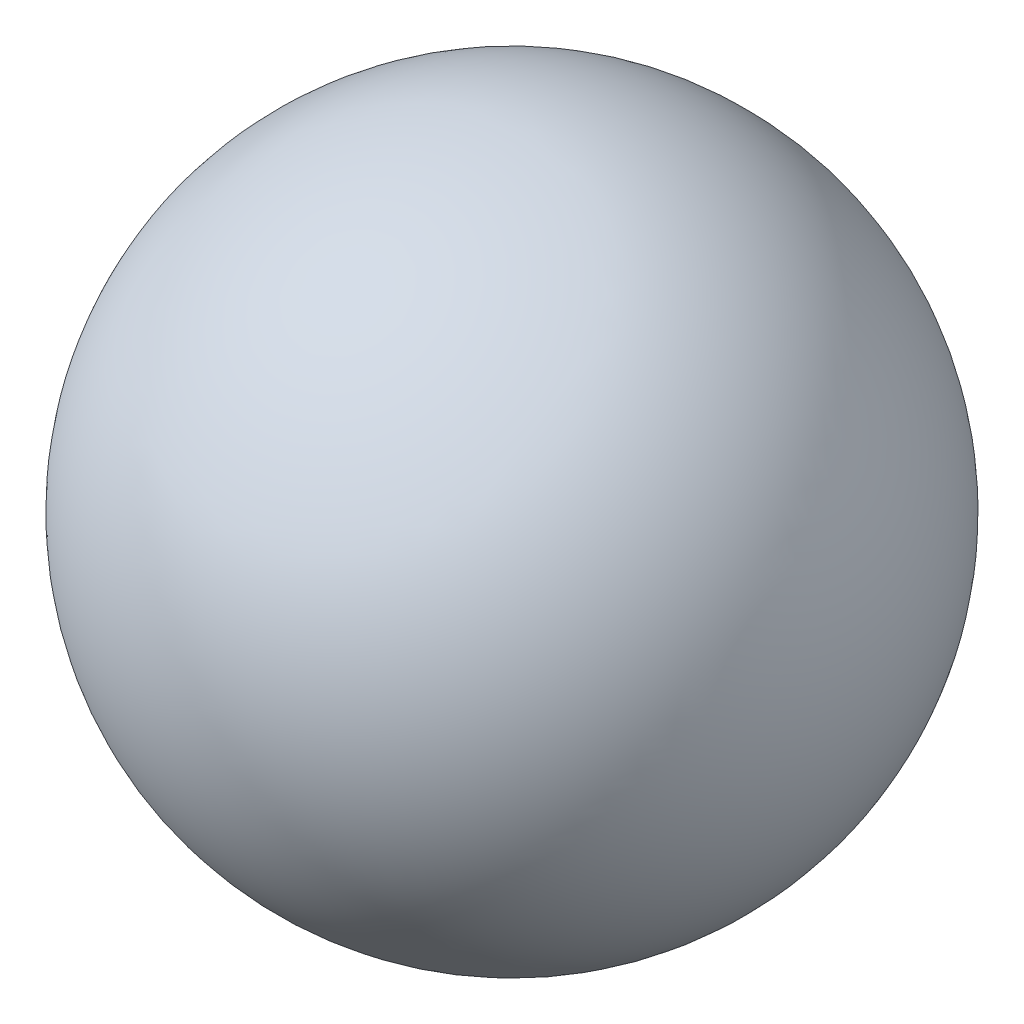
from build123d import *


with BuildPart() as part:
    # Sketch1 → Revolve1 (revolve)
    with BuildSketch(Plane.XY):
        with BuildLine():
            Line((0, 0), (300, 0))
            ThreePointArc((300, 0), (150, 150), (0, 0))
        make_face()
    revolve(axis=Axis((0, 0, 0), (1, 0, 0)))


solid = part.part
